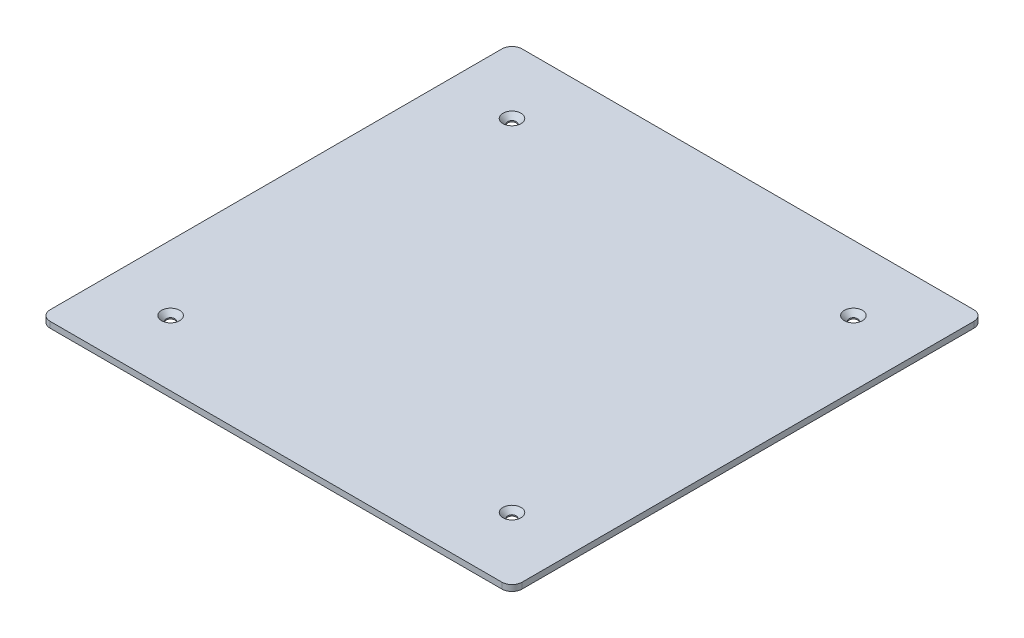
from build123d import *

# Parameters (mm, degrees)
BOSS_EXTRUDE1_DEPTH = 3
SKETCH2_R           = 2.1
CUT_EXTRUDE1_DEPTH  = 3
FILLET1_R           = 5
CHAMFER1_SIZE       = 2.4


with BuildPart() as part:
    # Sketch1 → Boss-Extrude1 (new body)
    with BuildSketch(Plane(origin=(0, 0, 0), x_dir=(1, 0, 0), z_dir=(0, 1, 0))):
        Polygon((0, 0), (-117.5, 117.5), (-117.5, -67.83865663), align=None)
        Polygon((0, 117.5), (-117.5, 117.5), (0, 0), align=None)
        Polygon((0, 117.5), (0, 0), (117.5, -67.83865663), (117.5, 117.5), align=None)
        Polygon((117.5, -67.83865663), (0, 0), (117.5, -117.5), align=None)
        Polygon((117.5, -117.5), (0, 0), (-117.5, -67.83865663), (-117.5, -117.5), align=None)
    extrude(amount=BOSS_EXTRUDE1_DEPTH)

    # Sketch2 → Cut-Extrude1 (cut)
    with BuildSketch(Plane.XZ):
        with Locations(Location((85, -85, 0), (0, 0, 270))):
            Circle(SKETCH2_R)
        with Locations(Location((-85, 85, 0), (0, 0, 270))):
            Circle(SKETCH2_R)
        with Locations(Location((85, 85, 0), (0, 0, 270))):
            Circle(SKETCH2_R)
        with Locations(Location((-85, -85, 0), (0, 0, 270))):
            Circle(SKETCH2_R)
    extrude(amount=-CUT_EXTRUDE1_DEPTH, mode=Mode.SUBTRACT)

    # Fillet1
    fillet1_edges = [part.edges().sort_by_distance(p)[0] for p in [
        (-117.5, 1.5, 117.5),
        (-117.5, 1.5, -117.5),
        (117.5, 1.5, -117.5),
        (117.5, 1.5, 117.5),
    ]]
    fillet(fillet1_edges, radius=FILLET1_R)

    # Chamfer1
    chamfer1_edges = [part.edges().sort_by_distance(p)[0] for p in [
        (-85, 3, -82.9),
        (85, 3, 87.1),
        (-85, 3, 87.1),
        (85, 3, -82.9),
    ]]
    chamfer(chamfer1_edges, length=CHAMFER1_SIZE)


solid = part.part
